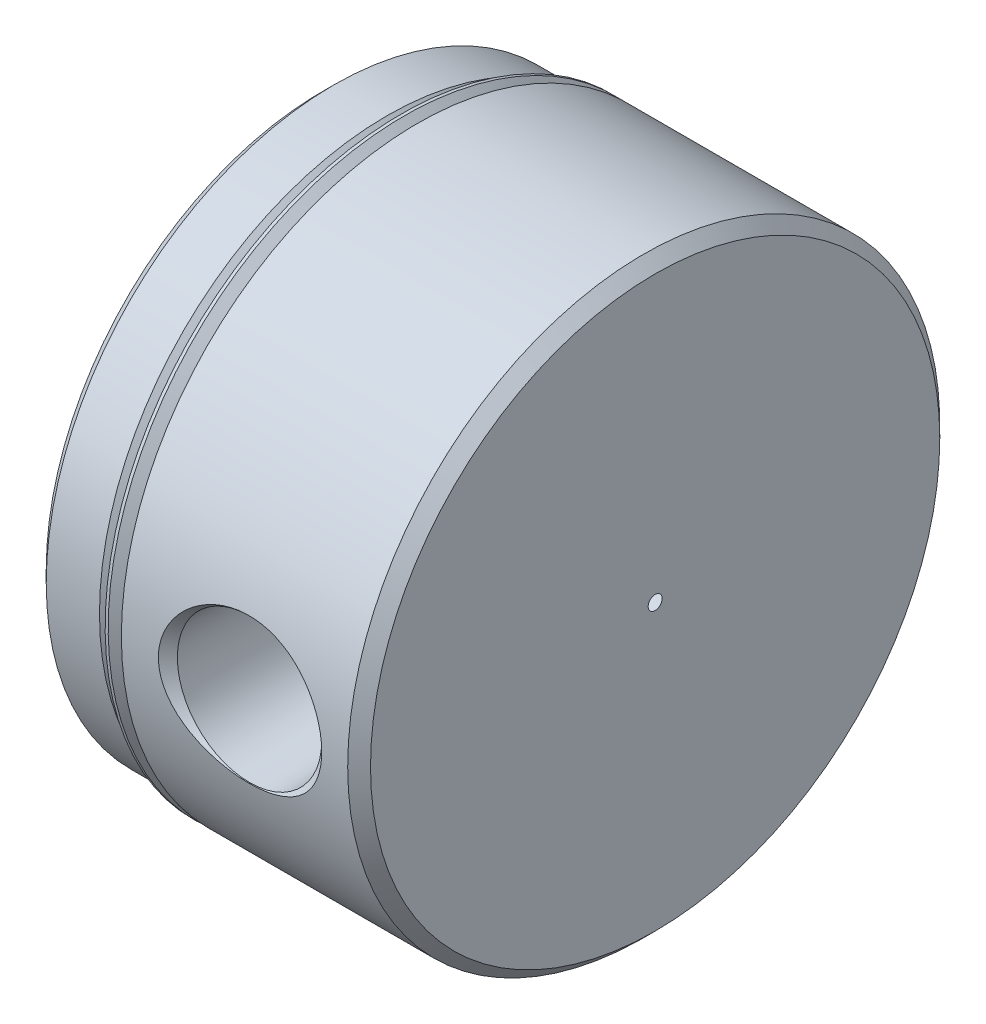
from build123d import *

# Parameters (mm, degrees)
HOLE1_D     = 13.5128
HOLE1_DEPTH = 18.5928
HOLE1_TIP   = 3.900809359
SKETCH5_W   = 6.35
SKETCH5_H   = 12.3063


with BuildPart() as part:
    # Sketch1 → Revolve1 (revolve)
    with BuildSketch(Plane.XY):
        Polygon((0, 0), (0, 18.43405), (0.762, 19.19605), (4.318, 19.19605), (5.334, 18.18005), (6.35, 18.18005), (6.35, 19.76755), (21.463, 19.76755), (22.225, 19.00555), (22.225, 0), align=None)
    revolve(axis=Axis((22.225, 0, 0), (-1, 0, 0)))

    # Hole1
    with Locations(Plane.ZY):
        with Locations((0, 0)):
            Hole(HOLE1_D / 2, depth=HOLE1_DEPTH)
            with Locations((0, 0, -(HOLE1_DEPTH + HOLE1_TIP / 2))):  # 120° drill point
                Cone(0, HOLE1_D / 2, HOLE1_TIP, mode=Mode.SUBTRACT)

    # Sketch4 → Cut-Revolve1 (revolve, cut)
    with BuildSketch(Plane(origin=(0, 0, 0), x_dir=(1, 0, 0), z_dir=(0, 1, 0))):
        Polygon((14.2748, 0), (18.86262618, 0), (18.86262618, -11.706901754), (19.094451116, -19.132537191), (19.729463925, -19.76755), (14.2748, -19.76755), align=None)
    revolve(axis=Axis((14.2748, 0, 19.76755), (0, 0, -1)), mode=Mode.SUBTRACT)

    # Sketch5 → Cut-Revolve2 (revolve, cut)
    with BuildSketch(Plane.XY):
        with Locations((3.175, 6.15315)):
            Rectangle(SKETCH5_W, SKETCH5_H)
    revolve(axis=Axis((6.35, 0, 0), (-1, 0, 0)), mode=Mode.SUBTRACT)

    # Sketch6 → Revolve2 (revolve)
    with BuildSketch(Plane.XY):
        with BuildLine():
            Line((5.267509175, 19.683381804), (6.216617928, 18.734273051))
            ThreePointArc((6.216617928, 18.734273051), (6.253815367, 18.64447049), (6.216617928, 18.554667928))
            Line((6.216617928, 18.554667928), (5.842, 18.18005))
            Line((5.842, 18.18005), (5.334, 18.18005))
            Line((5.334, 18.18005), (5.334, 17.92605))
            Line((5.334, 17.92605), (6.35, 17.92605))
            Line((6.35, 17.92605), (6.35, 18.888259175))
            Line((6.35, 18.888259175), (5.470709175, 19.76755))
            Line((5.470709175, 19.76755), (5.267509175, 19.76755))
            Line((5.267509175, 19.76755), (5.267509175, 19.683381804))
        make_face()
    revolve(axis=Axis((6.35, 0, 0), (-1, 0, 0)))


solid = part.part
